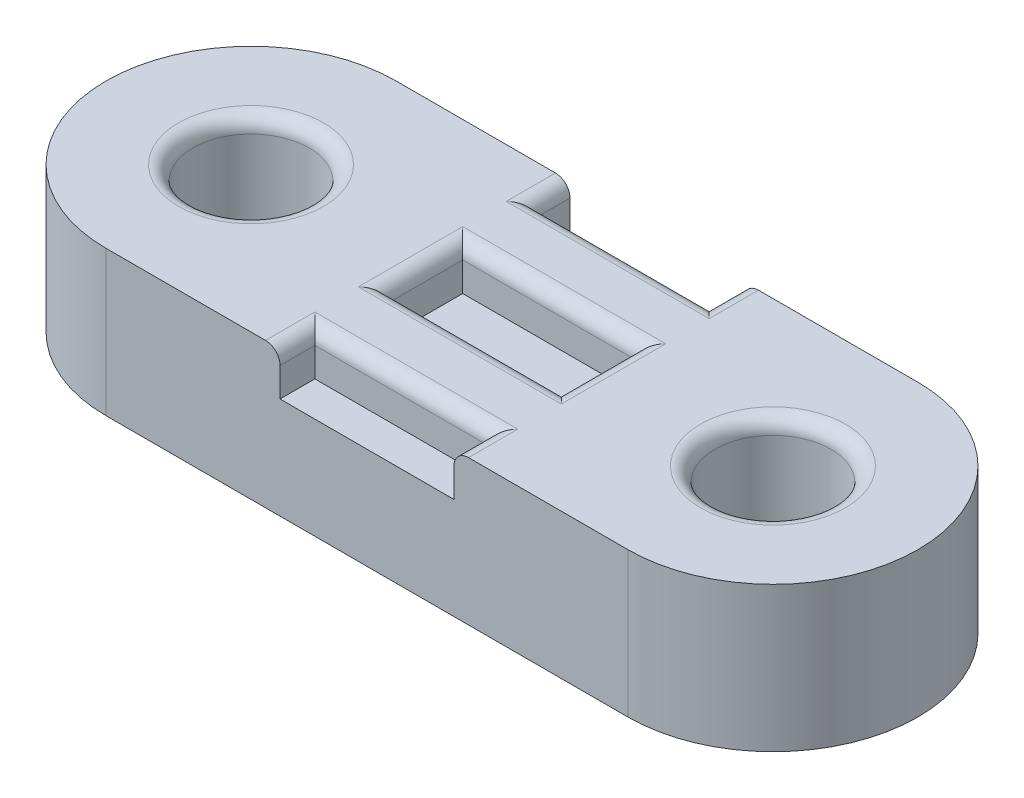
from build123d import *

# Parameters (mm, degrees)
BOSS_EXTRUDE1_DEPTH = 5
SCREW_HOLES_R       = 2
CUT_EXTRUDE1_DEPTH  = 5
FILLET2_R           = 0.5
BELT_CUT_OUTS_W     = 6
BELT_CUT_OUTS_H     = 1.2
BELT_CUT_OUTS_H_2   = 2.6
CUT_EXTRUDE2_DEPTH  = 1.5
FILLET3_R           = 0.5


with BuildPart() as part:
    # Belt Clamp → Boss-Extrude1 (new body)
    with BuildSketch(Plane(origin=(0, 0, 0), x_dir=(1, 0, 0), z_dir=(0, 1, 0))):
        with BuildLine():
            Line((-18, 10), (0, 10))
            ThreePointArc((0, 10), (5, 5), (0, 0))
            Line((0, 0), (-18, 0))
            ThreePointArc((-18, 0), (-23, 5), (-18, 10))
        make_face()
    extrude(amount=BOSS_EXTRUDE1_DEPTH)

    # Screw Holes → Cut-Extrude1 (cut)
    with BuildSketch(Plane.XZ):
        with Locations(Location((-18, -5, 0), (0, 0, 270))):
            Circle(SCREW_HOLES_R)
        with Locations(Location((0, -5, 0), (0, 0, 270))):
            Circle(SCREW_HOLES_R)
    extrude(amount=-CUT_EXTRUDE1_DEPTH, mode=Mode.SUBTRACT)

    # Fillet2
    fillet2_edges = [part.edges().sort_by_distance(p)[0] for p in [
        (-18, 0, -3),
        (-18, 5, -3),
        (0, 0, -3),
        (0, 5, -3),
    ]]
    fillet(fillet2_edges, radius=FILLET2_R)

    # Belt cut outs → Cut-Extrude2 (cut)
    with BuildSketch(Plane(origin=(0, 5, 0), x_dir=(1, 0, 0), z_dir=(0, 1, 0))):
        with Locations((-9, 0.6)):
            Rectangle(BELT_CUT_OUTS_W, BELT_CUT_OUTS_H)
        with Locations((-9, 5)):
            Rectangle(BELT_CUT_OUTS_W, BELT_CUT_OUTS_H_2)
        with Locations((-9, 9.4)):
            Rectangle(BELT_CUT_OUTS_W, BELT_CUT_OUTS_H)
    extrude(amount=-CUT_EXTRUDE2_DEPTH, mode=Mode.SUBTRACT)

    # Fillet3
    fillet3_edges = [part.edges().sort_by_distance(p)[0] for p in [
        (-12, 5, -0.6),
        (-6, 5, -0.6),
        (-9, 5, -1.2),
        (-12, 5, -9.4),
        (-9, 5, -8.8),
        (-6, 5, -9.4),
        (-12, 5, -5),
        (-9, 5, -3.7),
        (-6, 5, -5),
        (-9, 5, -6.3),
    ]]
    fillet(fillet3_edges, radius=FILLET3_R)


solid = part.part
